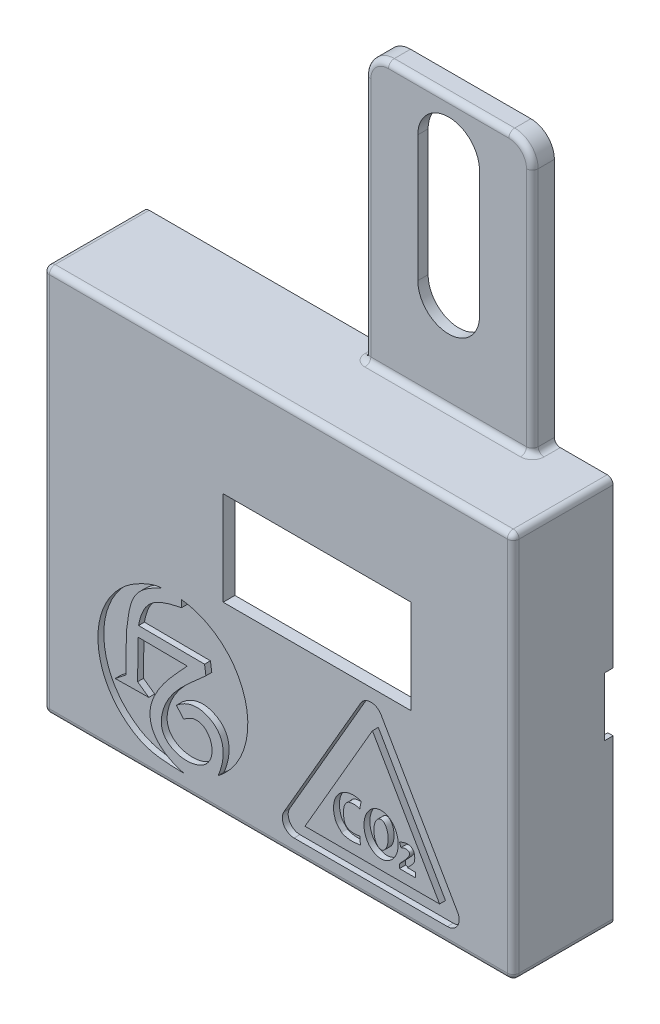
from build123d import *

# Parameters (mm, degrees)
CROQUIS1_W              = 80
CROQUIS1_H              = 66
SALIENTE_EXTRUIR2_DEPTH = 17
VACIADO7_T              = -2
CORTAR_EXTRUIR9_REACH   = 58.118
CROQUIS12_W             = 32
CROQUIS12_H             = 16
SALIENTE_EXTRUIR3_DEPTH = 3.75
CORTAR_EXTRUIR11_DEPTH  = 2
CORTAR_EXTRUIR26_REACH  = 117.461
CROQUIS16_W             = 10
CROQUIS16_H             = 12
CORTAR_EXTRUIR18_DEPTH  = 1
CROQUIS20_RX            = 3.568577335
CROQUIS20_RY            = 2.914426882
CROQUIS20_RX_2          = 2.232634343
CROQUIS20_RY_2          = 1.215365865
CORTAR_EXTRUIR24_DEPTH  = 1
CORTAR_EXTRUIR25_REACH  = 117.461
CROQUIS27_W             = 1.5
CROQUIS27_H             = 10
REDONDEO3_R             = 1


with BuildPart() as part:
    # Croquis1 → Saliente-Extruir2 (new body)
    with BuildSketch(Plane.XY):
        with Locations((0, 2.5)):
            Rectangle(CROQUIS1_W, CROQUIS1_H)
    extrude(amount=SALIENTE_EXTRUIR2_DEPTH)

    # Vaciado7
    vaciado7_openings = [part.faces().sort_by_distance(p)[0] for p in [
        (0, 2.5, 0),
    ]]
    offset(amount=VACIADO7_T, openings=vaciado7_openings, kind=Kind.INTERSECTION)

    # Croquis12 → Cortar-Extruir9 (cut, up to next)
    with BuildSketch(Plane.XY.offset(17), mode=Mode.PRIVATE) as cortar_extruir9_sk1:
        with Locations((6.6, 9)):
            Rectangle(CROQUIS12_W, CROQUIS12_H)
    cortar_extruir9_tool1 = extrude(cortar_extruir9_sk1.sketch, amount=-CORTAR_EXTRUIR9_REACH, mode=Mode.PRIVATE) & part.part
    add(cortar_extruir9_tool1.solids().sort_by_distance((6.6, 9, 17))[0], mode=Mode.SUBTRACT)

    # Croquis29 → Saliente-Extruir3 (add)
    with BuildSketch(Plane(origin=(0, 0, 0), x_dir=(-1, 0, 0), z_dir=(0, 0, -1))):
        with BuildLine():
            Line((-1.5, 77.5), (-1.5, 35.5))
            Line((-1.5, 35.5), (-30, 35.5))
            Line((-30, 35.5), (-30, 77.5))
            ThreePointArc((-30, 77.5), (-28.828427125, 80.328427125), (-26, 81.5))
            Line((-26, 81.5), (-5.5, 81.5))
            ThreePointArc((-5.5, 81.5), (-2.671572875, 80.328427125), (-1.5, 77.5))
        make_face()
        with BuildLine():
            Line((-10.5, 73.25), (-10.5, 51.75))
            ThreePointArc((-10.5, 51.75), (-15.75, 46.5), (-21, 51.75))
            Line((-21, 51.75), (-21, 73.25))
            ThreePointArc((-21, 73.25), (-15.75, 78.5), (-10.5, 73.25))
        make_face(mode=Mode.SUBTRACT)
    extrude(amount=-SALIENTE_EXTRUIR3_DEPTH)

    # Croquis14 → Cortar-Extruir11 (cut)
    with BuildSketch(Plane(origin=(0, 0, 0), x_dir=(-1, 0, 0), z_dir=(0, 0, -1))):
        with BuildLine():
            Line((39.1, 34.6), (-2.4, 34.6))
            Line((-2.4, 34.6), (-2.4, 77.5))
            ThreePointArc((-2.4, 77.5), (-3.307968978, 79.692031022), (-5.5, 80.6))
            Line((-5.5, 80.6), (-26, 80.6))
            ThreePointArc((-26, 80.6), (-28.192031022, 79.692031022), (-29.1, 77.5))
            Line((-29.1, 77.5), (-29.1, 34.6))
            Line((-29.1, 34.6), (-39.1, 34.6))
            Line((-39.1, 34.6), (-39.1, -29.6))
            Line((-39.1, -29.6), (39.1, -29.6))
            Line((39.1, -29.6), (39.1, 34.6))
        make_face()
    extrude(amount=-CORTAR_EXTRUIR11_DEPTH, mode=Mode.SUBTRACT)

    # Croquis16 → Cortar-Extruir26 (cut, up to next)
    with BuildSketch(Plane.ZY.offset(40), mode=Mode.PRIVATE) as cortar_extruir26_sk1:
        with Locations((7, -12.75)):
            Rectangle(CROQUIS16_W, CROQUIS16_H)
    cortar_extruir26_tool1 = extrude(cortar_extruir26_sk1.sketch, amount=-CORTAR_EXTRUIR26_REACH, mode=Mode.PRIVATE) & part.part
    add(cortar_extruir26_tool1.solids().sort_by_distance((-40, -12.75, 7))[0], mode=Mode.SUBTRACT)

    # Croquis19 → Cortar-Extruir18 (cut)
    with BuildSketch(Plane.XY.offset(17)):
        with BuildLine():
            Line((-25.879198939, -11.557780912), (-25.958886439, -18.012468412))
            Line((-25.958886439, -18.012468412), (-27.791698939, -19.446843412))
            Line((-27.791698939, -19.446843412), (-22.054198939, -19.367155912))
            Line((-22.054198939, -19.367155912), (-23.966698939, -18.012468412))
            Line((-23.966698939, -18.012468412), (-23.887011439, -11.398405912))
            Line((-23.887011439, -11.398405912), (-15.519823939, -11.478093412))
            add(Edge.make_bspline(
                [(-15.519823939, -11.478093412), (-17.545844486, -13.729227354), (-19.789885544, -15.918424263), (-21.097948939, -18.649968412), (-23.283048865, -23.212971199), (-20.506886895, -26.467655798), (-16.077636439, -27.574968412)],
                knots=[0, 0, 0, 0, 1, 1, 1, 2, 2, 2, 2], degree=3))
            add(Edge.make_bspline(
                [(-16.077636439, -27.574968412), (-20.47287026, -27.492039472), (-23.273395234, -27.39610462), (-26.676073939, -24.228093412), (-28.089954041, -22.911722282), (-29.291564933, -21.112218629), (-29.943261439, -19.287468412), (-31.866656617, -13.901961913), (-30.163281273, -8.110014432), (-25.640136439, -4.624968412), (-24.372618274, -3.648356055), (-21.52464389, -2.154655912), (-19.902636439, -2.154655912)],
                knots=[0, 0, 0, 0, 1, 1, 1, 2, 2, 2, 3, 3, 3, 4, 4, 4, 4], degree=3))
            add(Edge.make_bspline(
                [(-19.902636439, -2.154655912), (-24.89238413, -4.483204835), (-25.264344747, -6.270034861), (-25.879198939, -11.557780912)],
                knots=[0, 0, 0, 0, 1, 1, 1, 1], degree=3))
        make_face()
        with BuildLine():
            Line((-12.332323939, -11.318718412), (-12.571386439, -9.724968412))
            Line((-12.571386439, -9.724968412), (-23.807323939, -9.645280912))
            add(Edge.make_bspline(
                [(-23.807323939, -9.645280912), (-22.997948037, -5.274651041), (-20.937814043, -4.242316433), (-16.476073939, -3.349968412)],
                knots=[0, 0, 0, 0, 1, 1, 1, 1], degree=3))
            Line((-16.476073939, -3.349968412), (-16.476073939, -2.154655912))
            ThreePointArc((-16.476073939, -2.154655912), (-5.644725568, -11.490732727), (-10.260448939, -25.024968412))
            add(Edge.make_bspline(
                [(-10.260448939, -25.024968412), (-9.065150963, -22.199718651), (-8.612139109, -18.467839826), (-12.252636439, -17.056218412), (-14.15078044, -16.320203391), (-15.932343039, -16.970056689), (-17.352636439, -18.171843412)],
                knots=[0, 0, 0, 0, 1, 1, 1, 2, 2, 2, 2], degree=3))
            Line((-17.352636439, -18.171843412), (-16.157323939, -19.606218412))
            add(Edge.make_bspline(
                [(-16.157323939, -19.606218412), (-15.599511439, -19.314030912), (-15.097465395, -18.871251056), (-14.483886439, -18.729655912), (-11.48296264, -18.037135035), (-9.960872453, -22.853993696), (-12.810448939, -24.706218412), (-15.458204542, -26.427259554), (-20.450218214, -25.269180271), (-19.902636439, -21.279655912), (-19.28956224, -16.812972462), (-15.384057396, -14.135703142), (-12.332323939, -11.318718412)],
                knots=[0, 0, 0, 0, 1, 1, 1, 2, 2, 2, 3, 3, 3, 4, 4, 4, 4], degree=3))
        make_face()
    extrude(amount=-CORTAR_EXTRUIR18_DEPTH, mode=Mode.SUBTRACT)

    # Croquis20 → Cortar-Extruir24 (cut)
    # profile 1 of 4: a face of its own
    with BuildSketch(Plane.XY.offset(17)):
        with BuildLine():
            Line((17.492486188, -2.15823527), (30.515757194, -24.742441047))
            ThreePointArc((30.515757194, -24.742441047), (30.514973753, -26.741988454), (28.78318421, -27.741536066))
            Line((28.78318421, -27.741536066), (2.674358681, -27.741536066))
            ThreePointArc((2.674358681, -27.741536066), (0.94153602, -26.740197982), (0.943854681, -24.738861689))
            Line((0.943854681, -24.738861689), (14.029409205, -2.154655912))
            ThreePointArc((14.029409205, -2.154655912), (15.761980358, -1.157331357), (17.492486188, -2.15823527))
        make_face()
        Polygon((27.455464057, -25.075329963), (4.531036151, -25.075329963), (16.020593617, -5.245636875), align=None, mode=Mode.SUBTRACT)
    # profile 2 of 4: a face of its own
    with BuildSketch(Plane.XY.offset(17)):
        with BuildLine():
            add(Edge.make_bspline(
                [(13.862656428, -17.843324249), (13.609925045, -17.785001622), (13.363127239, -17.687516736), (13.10446228, -17.668356369), (12.832342125, -17.64819932), (12.558417593, -17.69061605), (12.287945506, -17.726678995), (10.871027447, -17.915601403), (10.960657265, -20.213915115), (11.296460852, -21.109391346), (11.685484329, -22.146787286), (13.040781256, -22.004564689), (13.862656428, -21.867585493)],
                knots=[0, 0, 0, 0, 1, 1, 1, 2, 2, 2, 3, 3, 3, 4, 4, 4, 4], degree=3))
            Line((13.862656428, -21.867585493), (13.979301681, -23.150683281))
            add(Edge.make_bspline(
                [(13.979301681, -23.150683281), (12.802633706, -23.297766778), (11.894855056, -23.408919798), (10.829879838, -22.917392774), (10.779953785, -22.894349981), (10.752116336, -22.839629272), (10.713234584, -22.800747521), (10.32948715, -22.417000086), (9.996984657, -22.180669839), (9.780072557, -21.692617613), (8.933608989, -19.788074586), (9.49059492, -17.428890192), (11.471428732, -16.618549087), (12.33065858, -16.267045968), (13.242711362, -16.277254858), (14.095946935, -16.618549087)],
                knots=[0, 0, 0, 0, 1, 1, 1, 2, 2, 2, 3, 3, 3, 4, 4, 4, 5, 5, 5, 5], degree=3))
            Line((14.095946935, -16.618549087), (13.862656428, -17.843324249))
        make_face()
    # profile 3 of 4: a face of its own
    with BuildSketch(Plane.XY.offset(17)):
        with Locations(Location((17.496191892, -19.824762959), (0, 0, -90.640192277))):
            Ellipse(CROQUIS20_RX, CROQUIS20_RY)
        with Locations(Location((17.481387144, -19.822474896), (0, 0, -89.299840613))):
            Ellipse(CROQUIS20_RX_2, CROQUIS20_RY_2, mode=Mode.SUBTRACT)
    # profile 4 of 4: a face of its own
    with BuildSketch(Plane.XY.offset(17)):
        with BuildLine():
            add(Edge.make_bspline(
                [(20.628081129, -23.267328535), (20.647522004, -23.014597152), (20.586553877, -22.742117436), (20.686403756, -22.509134387), (20.800030651, -22.244004964), (23.637738658, -19.826293558), (21.619565783, -19.826293558), (21.213309519, -19.826293558), (21.198336422, -19.975342868), (20.861371636, -20.059584065)],
                knots=[0, 0, 0, 0, 1, 1, 1, 2, 2, 2, 3, 3, 3, 3], degree=3))
            Line((20.861371636, -20.059584065), (20.628081129, -19.359712544))
            add(Edge.make_bspline(
                [(20.628081129, -19.359712544), (22.216795317, -18.56535545), (23.450682845, -18.953054788), (23.194276705, -20.876100839), (23.127658561, -21.375736918), (22.25171125, -22.142946626), (21.969501544, -22.450811761)],
                knots=[0, 0, 0, 0, 1, 1, 1, 2, 2, 2, 2], degree=3))
            Line((21.969501544, -22.450811761), (23.370459113, -22.450811761))
            Line((23.370459113, -22.450811761), (23.370459113, -23.269496264))
            Line((23.370459113, -23.269496264), (20.628081129, -23.267328535))
        make_face()
    extrude(amount=-CORTAR_EXTRUIR24_DEPTH, mode=Mode.SUBTRACT)

    # Croquis27 → Cortar-Extruir25 (cut, up to next)
    with BuildSketch(Plane(origin=(40, 0, 0), x_dir=(0, 0, -1), z_dir=(1, 0, 0)), mode=Mode.PRIVATE) as cortar_extruir25_sk1:
        with Locations((-0.75, 2.5)):
            Rectangle(CROQUIS27_W, CROQUIS27_H)
    cortar_extruir25_tool1 = extrude(cortar_extruir25_sk1.sketch, amount=-CORTAR_EXTRUIR25_REACH, mode=Mode.PRIVATE) & part.part
    add(cortar_extruir25_tool1.solids().sort_by_distance((40, 2.5, 0.75))[0], mode=Mode.SUBTRACT)

    # Redondeo3
    redondeo3_edges = [part.edges().sort_by_distance(p)[0] for p in [
        (-40, 2.5, 17),
        (0, -30.5, 17),
        (28.828427125, 80.328427125, 3.75),
        (15.75, 81.5, 3.75),
        (2.671572875, 80.328427125, 3.75),
        (1.5, 56.5, 3.75),
        (15.75, 35.5, 3.75),
        (1.5, 35.5, 1.875),
        (30, 56.5, 3.75),
        (30, 35.5, 1.875),
        (40, 2.5, 17),
        (40, -30.5, 8.5),
        (-40, -30.5, 8.5),
        (-40, 35.5, 8.5),
        (40, 35.5, 8.5),
        (0, 35.5, 17),
    ]]
    fillet(redondeo3_edges, radius=REDONDEO3_R)


solid = part.part
